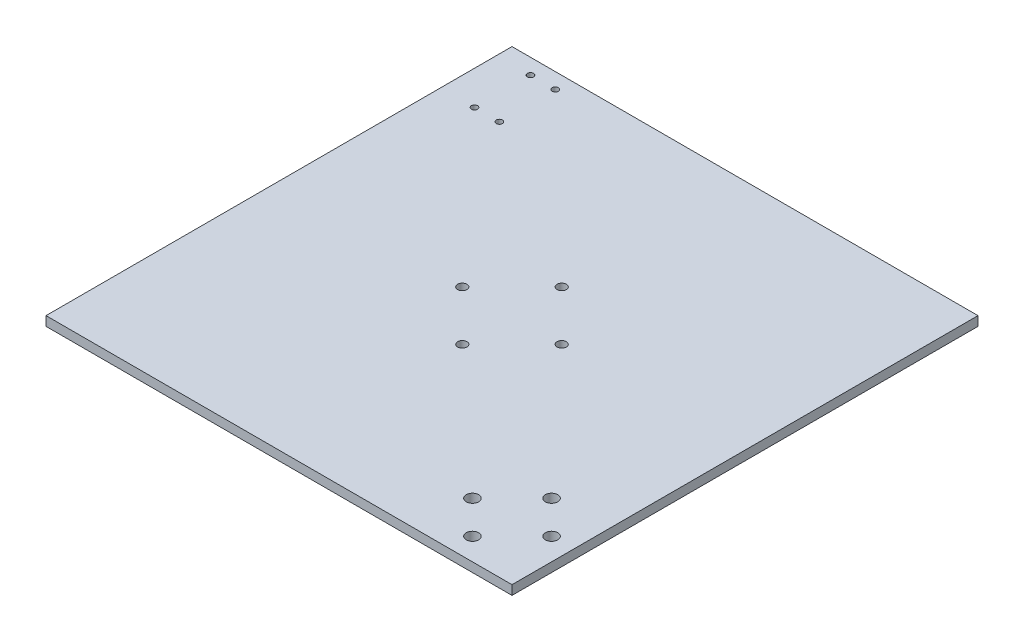
from build123d import *

# Parameters (mm, degrees)
SKETCH1_W           = 150
SKETCH1_H           = 150
BOSS_EXTRUDE1_DEPTH = 3
SKETCH2_R           = 1.5
SKETCH2_R_2         = 1
CUT_EXTRUDE1_DEPTH  = 10
SKETCH5_R           = 2
CUT_EXTRUDE2_DEPTH  = 10


with BuildPart() as part:
    # Sketch1 → Boss-Extrude1 (new body)
    with BuildSketch(Plane(origin=(0, 0, 0), x_dir=(1, 0, 0), z_dir=(0, 1, 0))):
        with Locations((75, 75)):
            Rectangle(SKETCH1_W, SKETCH1_H)
    extrude(amount=BOSS_EXTRUDE1_DEPTH)

    # Sketch2 → Cut-Extrude1 (cut)
    with BuildSketch(Plane(origin=(0, 3, 0), x_dir=(1, 0, 0), z_dir=(0, 1, 0))):
        with Locations(Location((75, 59, 0), (0, 0, 270))):
            Circle(SKETCH2_R)
        with Locations(Location((59, 75, 0), (0, 0, 270))):
            Circle(SKETCH2_R)
        with Locations(Location((75, 91, 0), (0, 0, 270))):
            Circle(SKETCH2_R)
        with Locations(Location((91, 75, 0), (0, 0, 270))):
            Circle(SKETCH2_R)
        with Locations(Location((18.93, 145, 0), (0, 0, 270))):
            Circle(SKETCH2_R_2)
        with Locations(Location((10.93, 145, 0), (0, 0, 270))):
            Circle(SKETCH2_R_2)
        with Locations(Location((18.93, 127, 0), (0, 0, 270))):
            Circle(SKETCH2_R_2)
        with Locations(Location((10.93, 127, 0), (0, 0, 270))):
            Circle(SKETCH2_R_2)
    extrude(amount=-CUT_EXTRUDE1_DEPTH, mode=Mode.SUBTRACT)

    # Sketch5 → Cut-Extrude2 (cut)
    with BuildSketch(Plane(origin=(0, 3, 0), x_dir=(1, 0, 0), z_dir=(0, 1, 0))):
        with Locations(Location((132.275691154, 30.452272789, 0), (0, 0, 270))):
            Circle(SKETCH5_R)
        with Locations(Location((119.547769092, 17.724350728, 0), (0, 0, 270))):
            Circle(SKETCH5_R)
        with Locations(Location((130.15437081, 7.11774901, 0), (0, 0, 270))):
            Circle(SKETCH5_R)
        with Locations(Location((142.882292871, 19.845671071, 0), (0, 0, 270))):
            Circle(SKETCH5_R)
    extrude(amount=-CUT_EXTRUDE2_DEPTH, mode=Mode.SUBTRACT)


solid = part.part
